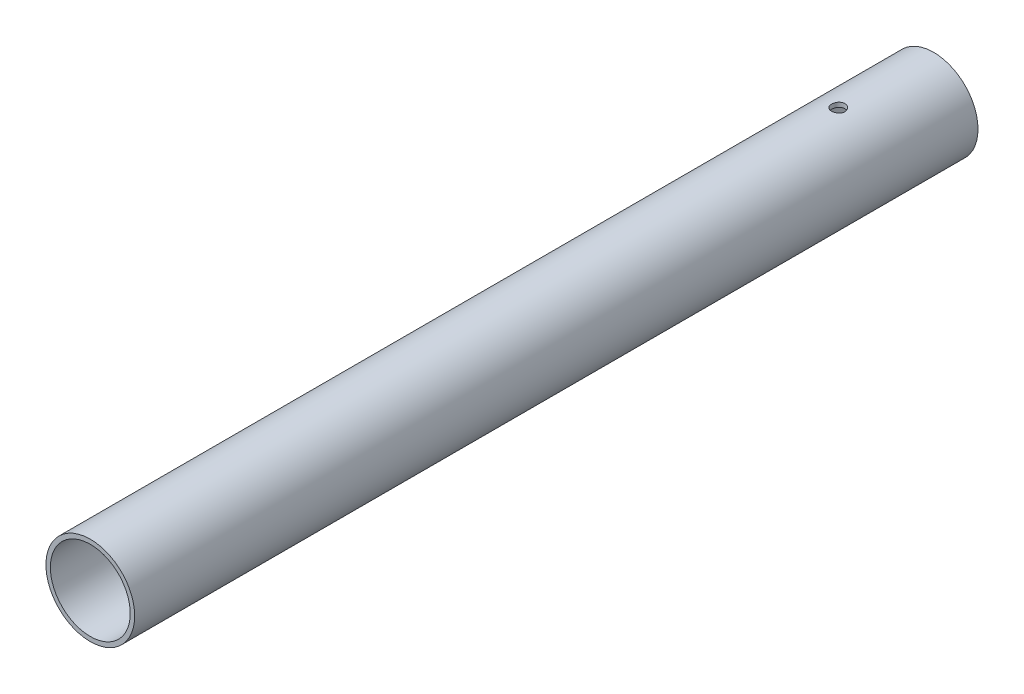
from build123d import *

# Parameters (mm, degrees)
SKETCH2_R               = 10
SKETCH2_R_2             = 9
BOSS_EXTRUDE1_DEPTH     = 190
CUT_EXTRUDE1_DEPTH      = 191.525588833
CUT_EXTRUDE1_DEPTH_BACK = 191.525588833
SKETCH3_R               = 1.5


with BuildPart() as part:
    # Sketch2 → Boss-Extrude1 (new body)
    with BuildSketch(Plane.XY):
        Circle(SKETCH2_R)
        Circle(SKETCH2_R_2, mode=Mode.SUBTRACT)
    extrude(amount=BOSS_EXTRUDE1_DEPTH)

    # Sketch3 → Cut-Extrude1 (cut, two sides: drawn at the far end of the back side and taken through both)
    with BuildSketch(Plane(origin=(0, 0, 0), x_dir=(1, 0, 0), z_dir=(0, 1, 0)).offset(-CUT_EXTRUDE1_DEPTH_BACK)):
        with Locations(Location((0, -21.5, 0), (0, 0, 270))):
            Circle(SKETCH3_R)
    extrude(amount=CUT_EXTRUDE1_DEPTH + CUT_EXTRUDE1_DEPTH_BACK, mode=Mode.SUBTRACT)


solid = part.part
